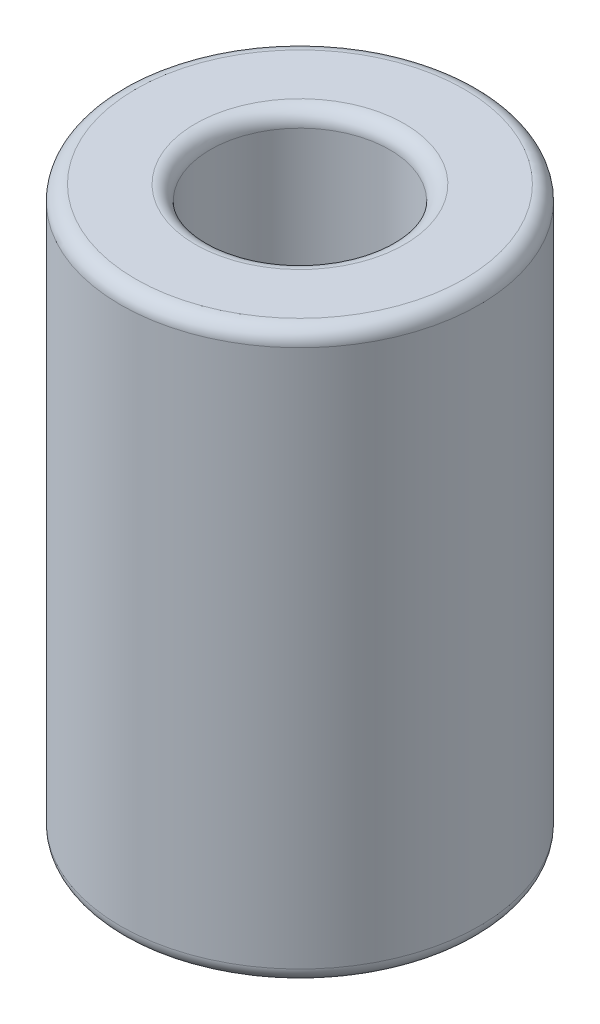
from build123d import *

# Parameters (mm, degrees)
SKETCH1_R           = 6
SKETCH1_R_2         = 3
BOSS_EXTRUDE1_DEPTH = 19
FILLET1_R           = 0.5


with BuildPart() as part:
    # Sketch1 → Boss-Extrude1 (new body)
    with BuildSketch(Plane(origin=(0, 0, 0), x_dir=(1, 0, 0), z_dir=(0, 1, 0))):
        with Locations(Location((0, 0, 0), (0, 0, 270))):
            Circle(SKETCH1_R)
        with Locations(Location((0, 0, 0), (0, 0, 270))):
            Circle(SKETCH1_R_2, mode=Mode.SUBTRACT)
    extrude(amount=BOSS_EXTRUDE1_DEPTH)

    # Fillet1
    fillet1_edges = [part.edges().sort_by_distance(p)[0] for p in [
        (0, 0, -6),
        (0, 19, -6),
        (0, 0, -3),
        (0, 19, -3),
    ]]
    fillet(fillet1_edges, radius=FILLET1_R)


solid = part.part
